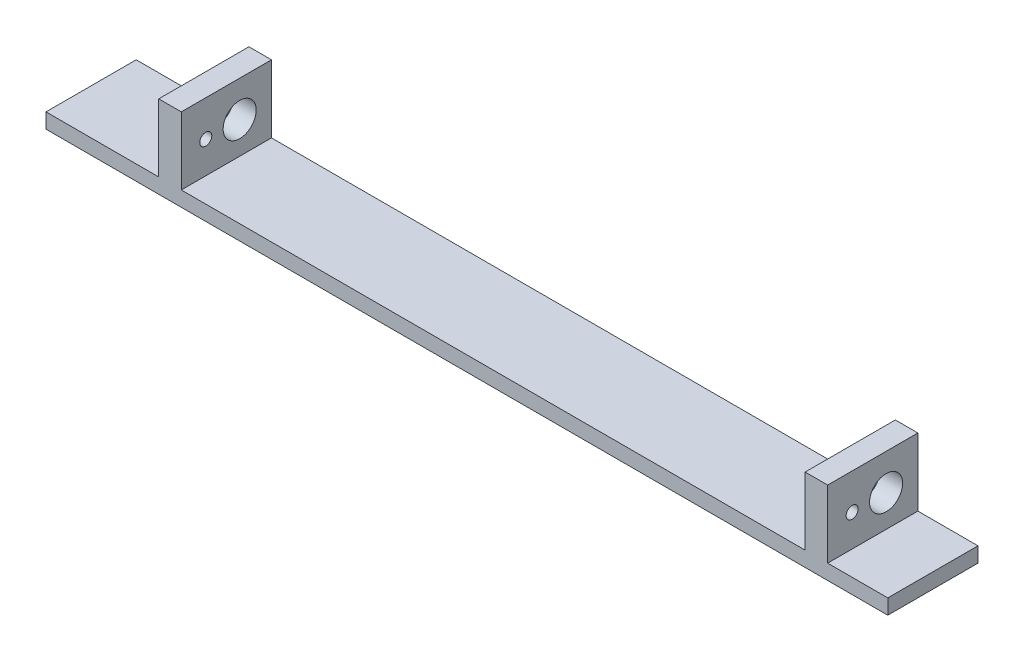
from build123d import *

# Parameters (mm, degrees)
SKETCH2_W           = 60
SKETCH2_H           = 10
BOSS_EXTRUDE1_DEPTH = 560
SKETCH4_W           = 15
SKETCH4_H           = 60
BOSS_EXTRUDE2_DEPTH = 45
SKETCH5_W           = 15
SKETCH5_H           = 60
BOSS_EXTRUDE3_DEPTH = 45
SKETCH6_R           = 11
SKETCH6_R_2         = 4
CUT_EXTRUDE1_DEPTH  = 455


with BuildPart() as part:
    # Sketch2 → Boss-Extrude1 (new body)
    with BuildSketch(Plane(origin=(0, 0, 0), x_dir=(0, 0, -1), z_dir=(1, 0, 0))):
        Rectangle(SKETCH2_W, SKETCH2_H)
    extrude(amount=BOSS_EXTRUDE1_DEPTH)

    # Sketch4 → Boss-Extrude2 (add)
    with BuildSketch(Plane(origin=(0, 5, 0), x_dir=(1, 0, 0), z_dir=(0, 1, 0))):
        with Locations((82.5, 0)):
            Rectangle(SKETCH4_W, SKETCH4_H)
    extrude(amount=BOSS_EXTRUDE2_DEPTH)

    # Sketch5 → Boss-Extrude3 (add)
    with BuildSketch(Plane(origin=(0, 5, 0), x_dir=(1, 0, 0), z_dir=(0, 1, 0))):
        with Locations((512.5, 0)):
            Rectangle(SKETCH5_W, SKETCH5_H)
    extrude(amount=BOSS_EXTRUDE3_DEPTH)

    # Sketch6 → Cut-Extrude1 (cut)
    with BuildSketch(Plane.ZY.offset(-75)):
        with Locations((-8.85, 26.15)):
            Circle(SKETCH6_R)
        with Locations((13.717950956, 26.15)):
            Circle(SKETCH6_R_2)
    extrude(amount=-CUT_EXTRUDE1_DEPTH, mode=Mode.SUBTRACT)


solid = part.part
